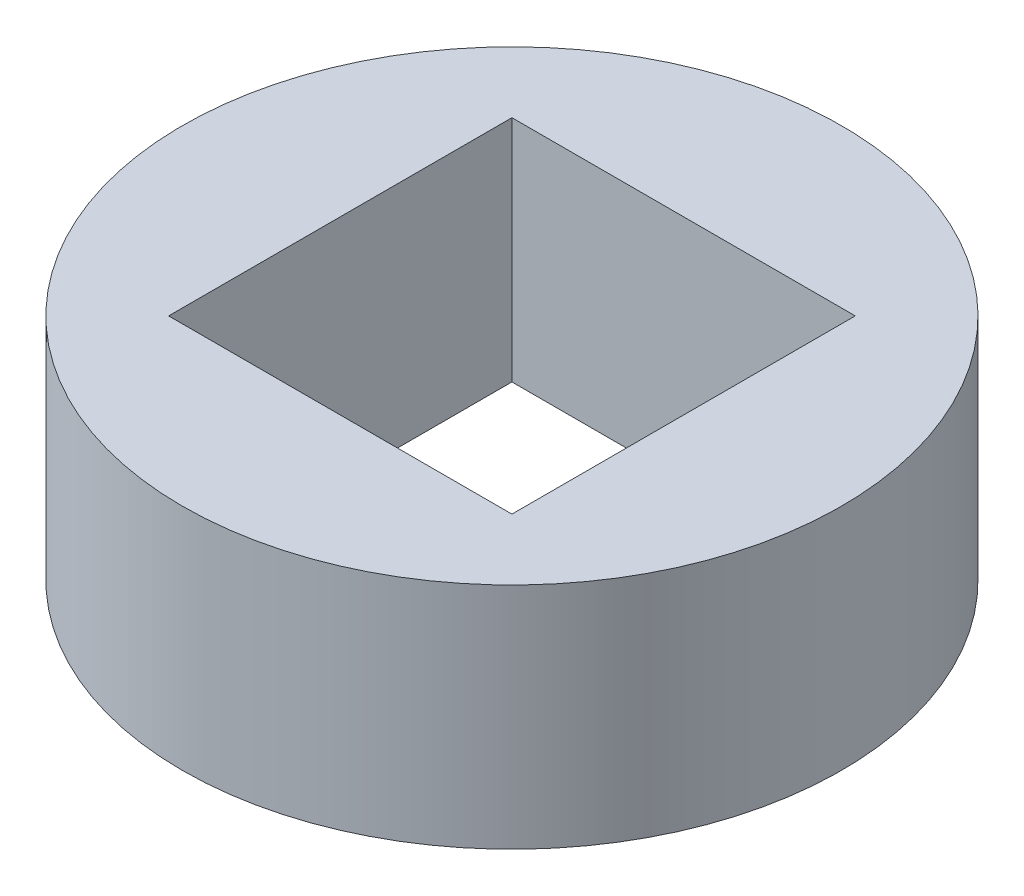
from build123d import *

# Parameters (mm, degrees)
SKETCH1_R           = 9.144
SKETCH1_W           = 9.525
SKETCH1_H           = 9.525
BOSS_EXTRUDE1_DEPTH = 6.35


with BuildPart() as part:
    # Sketch1 → Boss-Extrude1 (new body)
    with BuildSketch(Plane(origin=(0, 0, 0), x_dir=(1, 0, 0), z_dir=(0, 1, 0))):
        with Locations(Location((0, 0, 0), (0, 0, 270))):
            Circle(SKETCH1_R)
        Rectangle(SKETCH1_W, SKETCH1_H, mode=Mode.SUBTRACT)
    extrude(amount=BOSS_EXTRUDE1_DEPTH)


solid = part.part
